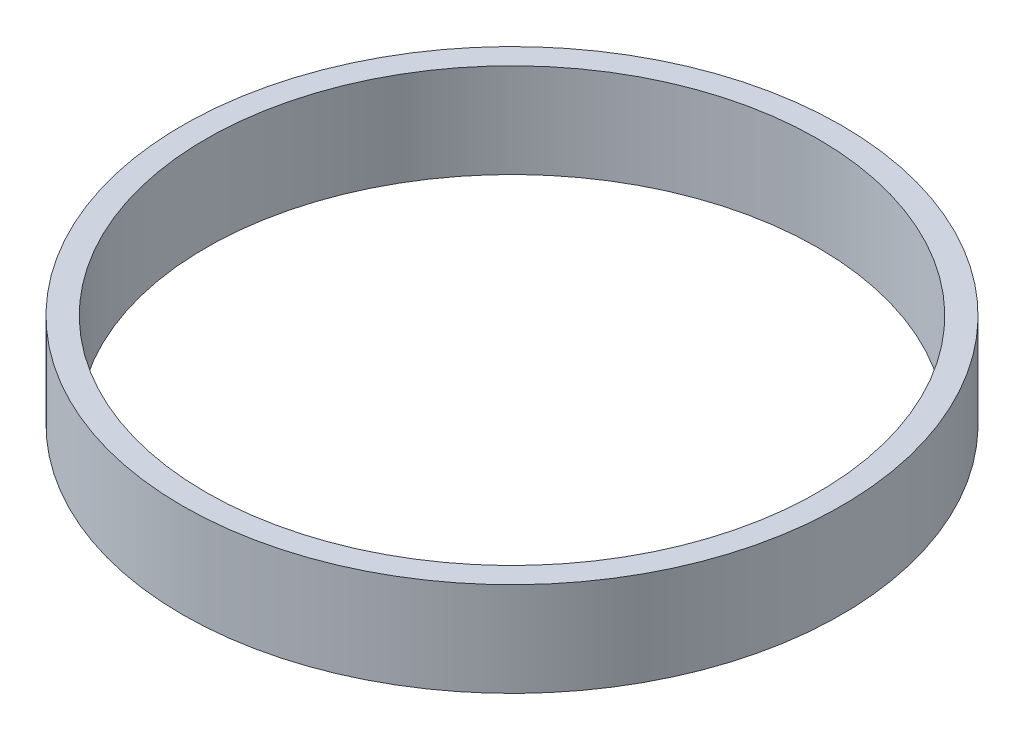
from build123d import *

# Parameters (mm, degrees)
SZKIC1_R                    = 70
SZKIC1_R_2                  = 65
DODANIE_WYCI_GNI_CIE1_DEPTH = 10


with BuildPart() as part:
    # Szkic1 → Dodanie-wyciągnięcie1 (new, symmetric)
    with BuildSketch(Plane(origin=(0, 0, 0), x_dir=(1, 0, 0), z_dir=(0, 1, 0))):
        with Locations(Location((0, 0, 0), (0, 0, 270))):
            Circle(SZKIC1_R)
        with Locations(Location((0, 0, 0), (0, 0, 270))):
            Circle(SZKIC1_R_2, mode=Mode.SUBTRACT)
    extrude(amount=DODANIE_WYCI_GNI_CIE1_DEPTH, both=True)


solid = part.part
